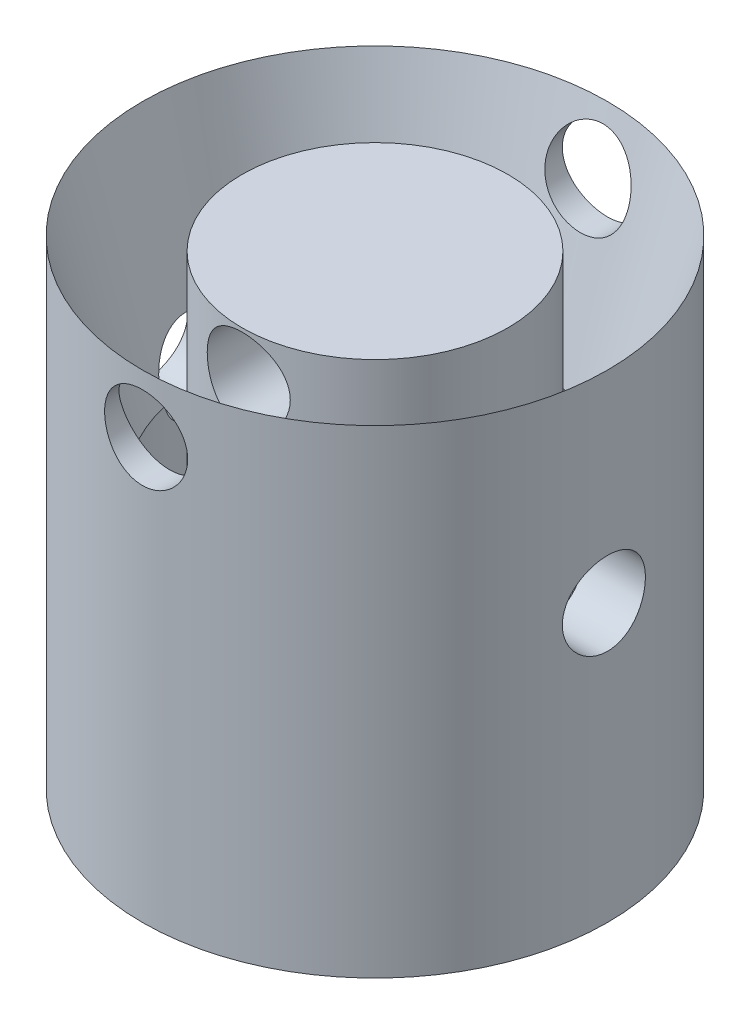
from build123d import *

# Parameters (mm, degrees)
CUT_EXTRUDE1_DEPTH      = 56.481705543
CUT_EXTRUDE1_DEPTH_BACK = 56.481705543
SKETCH2_R               = 3.96875
CUT_EXTRUDE2_DEPTH      = 56.481705706
CUT_EXTRUDE2_DEPTH_BACK = 56.481705706
SKETCH4_R               = 3.96875


with BuildPart() as part:
    # Sketch1 → Revolve1 (revolve)
    with BuildSketch(Plane.YZ, mode=Mode.PRIVATE) as revolve1_sk:
        Polygon((0, 0), (44.45, 0), (44.45, 12.7), (12.7, 12.7), (12.7, 16.7005), (25.4, 16.7005), (45.72, 22.225), (0, 22.225), align=None)
    revolve(revolve1_sk.sketch.rotate(Axis((0, 0, 0), (0, 1, 0)), 180), axis=Axis((0, 0, 0), (0, 1, 0)))

    # Sketch2 → Cut-Extrude1 (cut, two sides: drawn at the far end of the back side and taken through both)
    with BuildSketch(Plane(origin=(0, 0, 0), x_dir=(0, 1, 0), z_dir=(0, 0, 1)).offset(-CUT_EXTRUDE1_DEPTH_BACK)):
        with Locations(Location((40.132, 0, 0), (0, 0, 270))):
            Circle(SKETCH2_R)
    extrude(amount=CUT_EXTRUDE1_DEPTH + CUT_EXTRUDE1_DEPTH_BACK, mode=Mode.SUBTRACT)

    # Sketch4 → Cut-Extrude2 (cut, two sides: drawn at the far end of the back side and taken through both)
    with BuildSketch(Plane.YZ.offset(-CUT_EXTRUDE2_DEPTH_BACK)):
        with Locations(Location((26.416, 0, 0), (0, 0, 270))):
            Circle(SKETCH4_R)
    extrude(amount=CUT_EXTRUDE2_DEPTH + CUT_EXTRUDE2_DEPTH_BACK, mode=Mode.SUBTRACT)


solid = part.part
